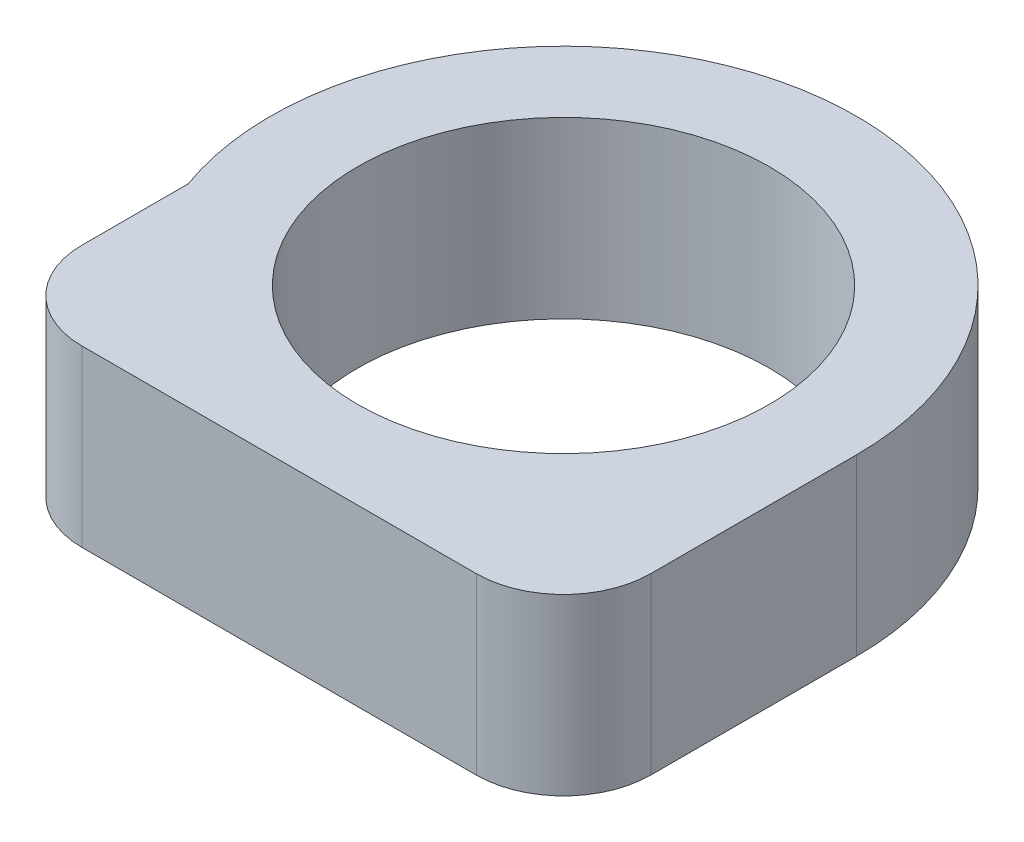
from build123d import *

# Parameters (mm, degrees)
SKETCH1_R           = 11.8
BOSS_EXTRUDE2_DEPTH = 10
FILLET1_R           = 5


with BuildPart() as part:
    # Sketch1 → Boss-Extrude2 (new body)
    with BuildSketch(Plane(origin=(0, 0, 0), x_dir=(1, 0, 0), z_dir=(0, 1, 0))):
        with BuildLine():
            Line((14.087461292, -15.184019493), (14.087461292, 1.615980507))
            ThreePointArc((14.087461292, 1.615980507), (-5.610814057, 18.164092181), (-18.512538708, -4.093660463))
            Line((-18.512538708, -4.093660463), (-18.512538708, -15.184019493))
            Line((-18.512538708, -15.184019493), (14.087461292, -15.184019493))
        make_face()
        with Locations(Location((-2.712538708, 1.615980507, 0), (0, 0, 270))):
            Circle(SKETCH1_R, mode=Mode.SUBTRACT)
    extrude(amount=BOSS_EXTRUDE2_DEPTH)

    # Fillet1
    fillet1_edges = [part.edges().sort_by_distance(p)[0] for p in [
        (14.087461292, 5, 15.184019493),
        (-18.512538708, 5, 15.184019493),
    ]]
    fillet(fillet1_edges, radius=FILLET1_R)


solid = part.part
